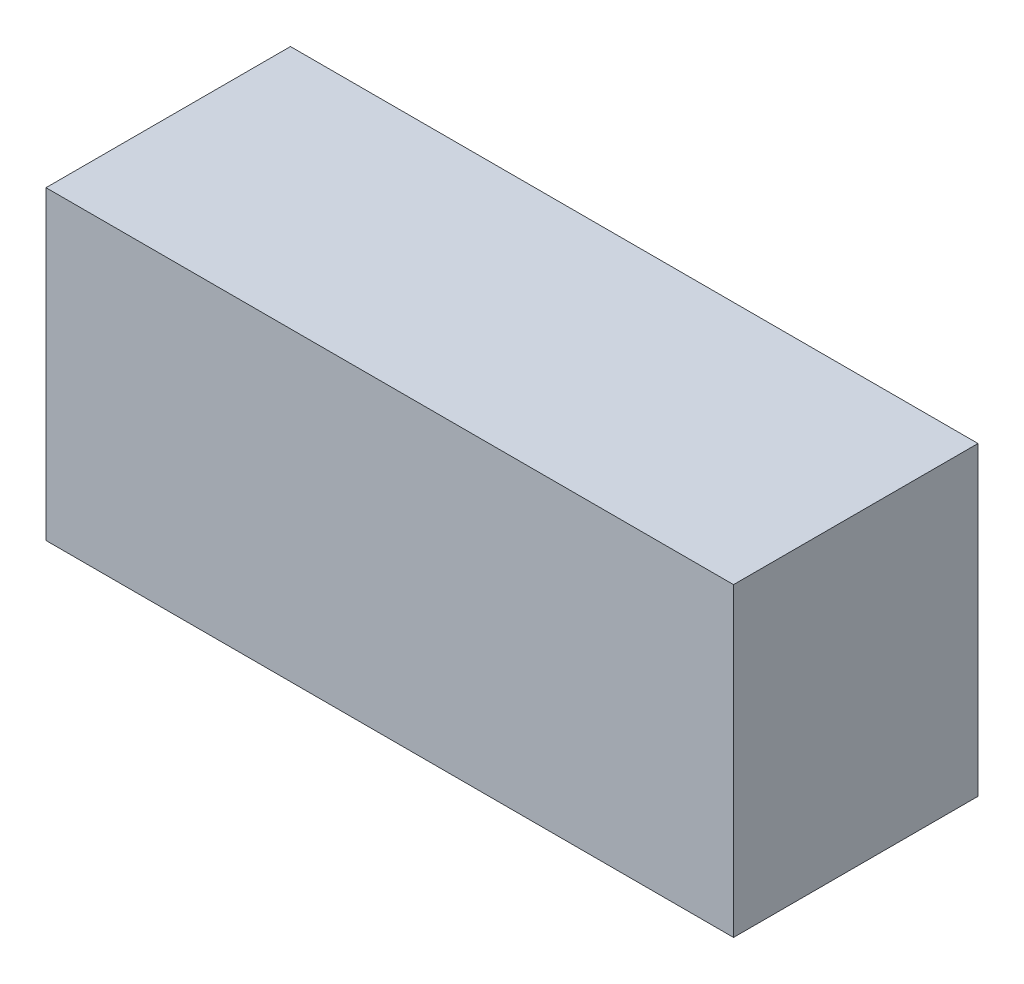
from build123d import *

# Parameters (mm, degrees)
SKETCH_1_W      = 45
SKETCH_1_H      = 16
EXTRUDE_1_DEPTH = 20


with BuildPart() as part:
    # 草图1 → 凸台-拉伸1 (new body)
    with BuildSketch(Plane(origin=(0, 0, 0), x_dir=(1, 0, 0), z_dir=(0, 1, 0))):
        Rectangle(SKETCH_1_W, SKETCH_1_H)
    extrude(amount=EXTRUDE_1_DEPTH)


solid = part.part
